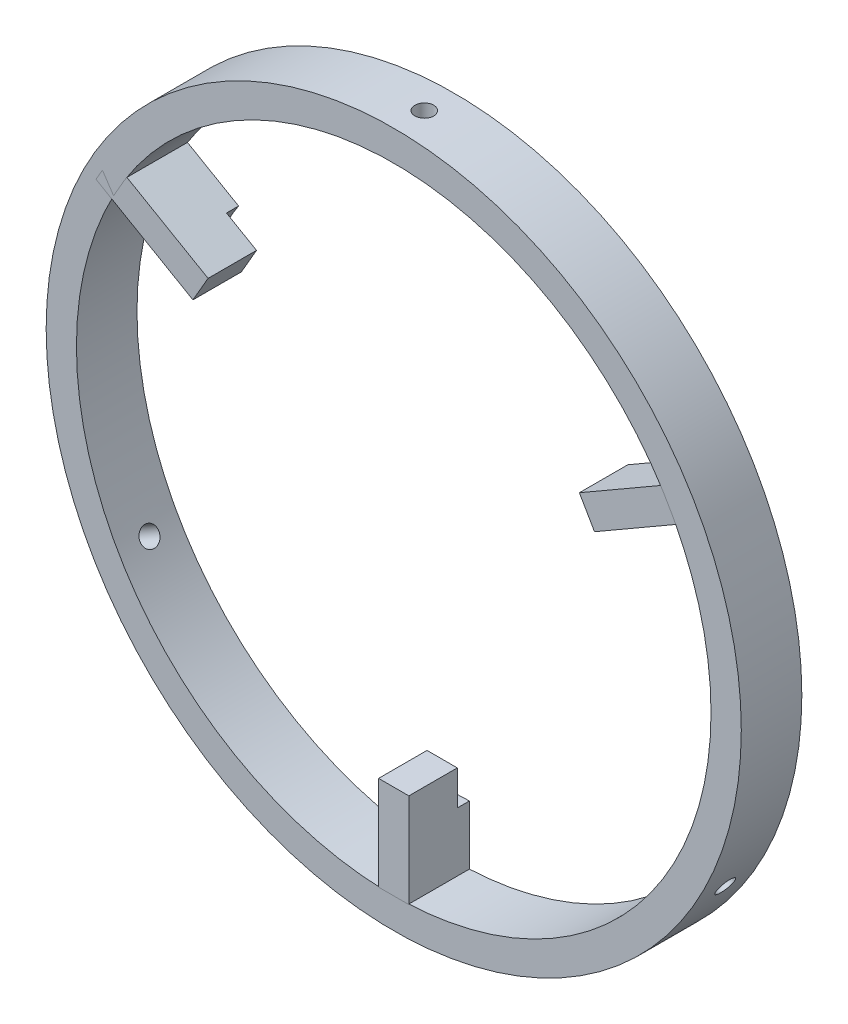
from build123d import *

# Parameters (mm, degrees)
SKETCH_1_R                 = 57.404900142
SKETCH_1_R_2               = 52.404900142
EXTRUDE_1_DEPTH            = 10
EXTRUDE_1_2_DEPTH          = 10
SKETCH_1_W                 = 5
SKETCH_1_H                 = 15.558252754
EXTRUDE_1_3_DEPTH          = 10
EXTRUDE_1_4_DEPTH          = 10
CUT_EXTRUDE_1_REACH        = 83.796
CUT_EXTRUDE_1_END_RADIUS   = 57.404900142
SKETCH_3_R                 = 1.55
PATTERN_CIRCULAR_1_COUNT   = 3
CUT_EXTRUDE_1_2_DEPTH      = 82.796363895
CUT_EXTRUDE_1_2_DEPTH_BACK = 2


with BuildPart() as part:
    # 草图1 → 拉伸-薄壁1 (new body)
    with BuildSketch(Plane.XY):
        Circle(SKETCH_1_R)
        Circle(SKETCH_1_R_2, mode=Mode.SUBTRACT)
    extrude(amount=EXTRUDE_1_DEPTH)

    # Cut-Extrude 1: up to this cylinder (the profile starts inside it)
    cut_extrude_1_end = Plane(origin=(0, 0, 4.960066), z_dir=(0, 0, -1)) * Cylinder(CUT_EXTRUDE_1_END_RADIUS, 283.401800284, mode=Mode.PRIVATE)
    # 草图3 → Cut-Extrude 1 (cut, up to the surface)
    with BuildSketch(Plane(origin=(0, 0, 0), x_dir=(1, 0, 0), z_dir=(0, 1, 0)), mode=Mode.PRIVATE) as cut_extrude_1_sk1:
        with Locations(Location((0, -4.960065679, 0), (0, 0, 90))):
            Circle(SKETCH_3_R)
    cut_extrude_1_tool1 = extrude(cut_extrude_1_sk1.sketch, amount=CUT_EXTRUDE_1_REACH, mode=Mode.PRIVATE) & cut_extrude_1_end
    cut_extrude_1 = cut_extrude_1_tool1.solids().sort_by_distance((0, 0, 4.960066))[0]
    add(cut_extrude_1, mode=Mode.SUBTRACT)

    # 阵列(圆周)1: Cut-Extrude 1 ×3 about axis
    pattern_circular_1_axis = Axis((0, 0, 10), (0, 0, -1))
    for i in range(1, PATTERN_CIRCULAR_1_COUNT):
        add(cut_extrude_1.rotate(pattern_circular_1_axis, i * 360 / PATTERN_CIRCULAR_1_COUNT), mode=Mode.SUBTRACT)


with BuildPart() as body_2:
    # 草图1 → Extrude 1 2 (new body)
    with BuildSketch(Plane.XY):
        Polygon((33.162241497, 16.259477709), (48.799038315, 25.287386561), (46.299038315, 29.61751358), (30.662241497, 20.589604728), align=None)
    extrude(amount=EXTRUDE_1_2_DEPTH)


with BuildPart() as body_3:
    # 草图1 → Extrude 1 3 (new body)
    with BuildSketch(Plane.XY):
        with Locations((0, -44.628208814)):
            Rectangle(SKETCH_1_W, SKETCH_1_H)
    extrude(amount=EXTRUDE_1_3_DEPTH)


with BuildPart() as body_4:
    # 草图1 → Extrude 1 4 (new body)
    with BuildSketch(Plane.XY):
        Polygon((-30.662241497, 20.589604728), (-46.673106184, 29.833481765), (-49.173106184, 25.503354746), (-33.162241497, 16.259477709), align=None)
    extrude(amount=EXTRUDE_1_4_DEPTH)


with BuildPart() as cut_extrude_1_2_tool:
    # 草图4 → Cut-Extrude 1 2 (new, two sides: drawn at the far end of the back side and taken through both)
    with BuildSketch(Plane(origin=(0, 0, 0), x_dir=(-1, 0, 0), z_dir=(0, 0, -1)).offset(-CUT_EXTRUDE_1_2_DEPTH_BACK)):
        with BuildLine():
            ThreePointArc((-7.526470588, 41.980647214), (0, -42.65), (7.526470588, 41.980647214))
            Line((7.526470588, 41.980647214), (6.326470588, 35.287367001))
            ThreePointArc((6.326470588, 35.287367001), (0, -35.85), (-6.326470588, 35.287367001))
            Line((-6.326470588, 35.287367001), (-7.526470588, 41.980647214))
        make_face()
    extrude(amount=CUT_EXTRUDE_1_2_DEPTH + CUT_EXTRUDE_1_2_DEPTH_BACK)


with BuildPart() as body_2_1:
    add(body_2.part)

    # Cut-Extrude 1 2: cut by cut_extrude_1_2_tool
    add(cut_extrude_1_2_tool.part, mode=Mode.SUBTRACT)


with BuildPart() as body_3_1:
    add(body_3.part)

    # Cut-Extrude 1 2: cut by cut_extrude_1_2_tool
    add(cut_extrude_1_2_tool.part, mode=Mode.SUBTRACT)


with BuildPart() as body_4_1:
    add(body_4.part)

    # Cut-Extrude 1 2: cut by cut_extrude_1_2_tool
    add(cut_extrude_1_2_tool.part, mode=Mode.SUBTRACT)


solid = Compound([part.part, body_2_1.part, body_3_1.part, body_4_1.part])
